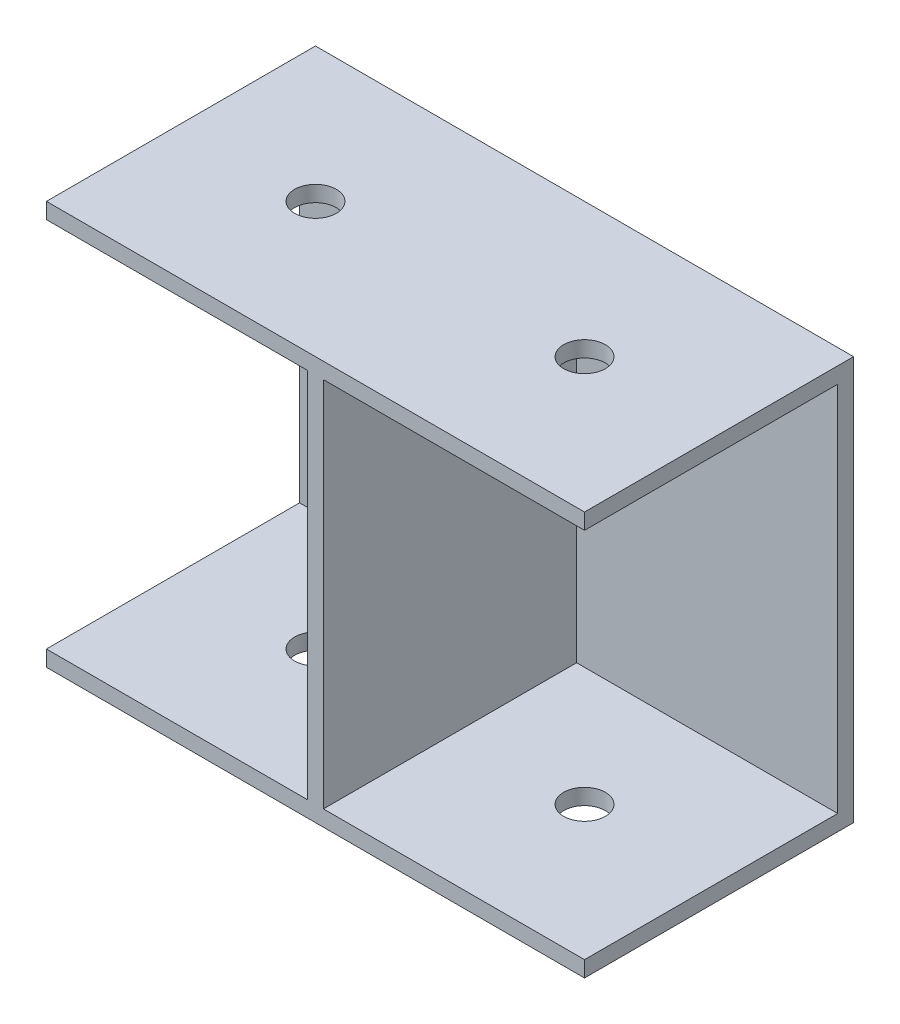
from build123d import *

# Parameters (mm, degrees)
SKETCH1_W           = 101.6
SKETCH1_H           = 76.2
BOSS_EXTRUDE1_DEPTH = 50.8
SKETCH3_W           = 49.3
SKETCH3_H           = 70.2
CUT_EXTRUDE1_DEPTH  = 47.8
SKETCH4_R           = 3.937
CUT_EXTRUDE3_DEPTH  = 50.8


with BuildPart() as part:
    # Sketch1 → Boss-Extrude1 (new body)
    with BuildSketch(Plane.XY):
        Rectangle(SKETCH1_W, SKETCH1_H)
    extrude(amount=BOSS_EXTRUDE1_DEPTH)

    # Sketch3 → Cut-Extrude1 (cut)
    with BuildSketch(Plane.XY.offset(50.8)):
        with Locations((-26.15, 0)):
            Rectangle(SKETCH3_W, SKETCH3_H)
        with Locations((26.15, 0)):
            Rectangle(SKETCH3_W, SKETCH3_H)
    extrude(amount=-CUT_EXTRUDE1_DEPTH, mode=Mode.SUBTRACT)

    # Sketch4 → Cut-Extrude3 (cut, symmetric)
    with BuildSketch(Plane(origin=(0, 0, 0), x_dir=(1, 0, 0), z_dir=(0, 1, 0))):
        with Locations(Location((25.4, -25.4, 0), (0, 0, 270))):
            Circle(SKETCH4_R)
        with Locations(Location((-25.4, -25.4, 0), (0, 0, 270))):
            Circle(SKETCH4_R)
    extrude(amount=CUT_EXTRUDE3_DEPTH, both=True, mode=Mode.SUBTRACT)


solid = part.part
